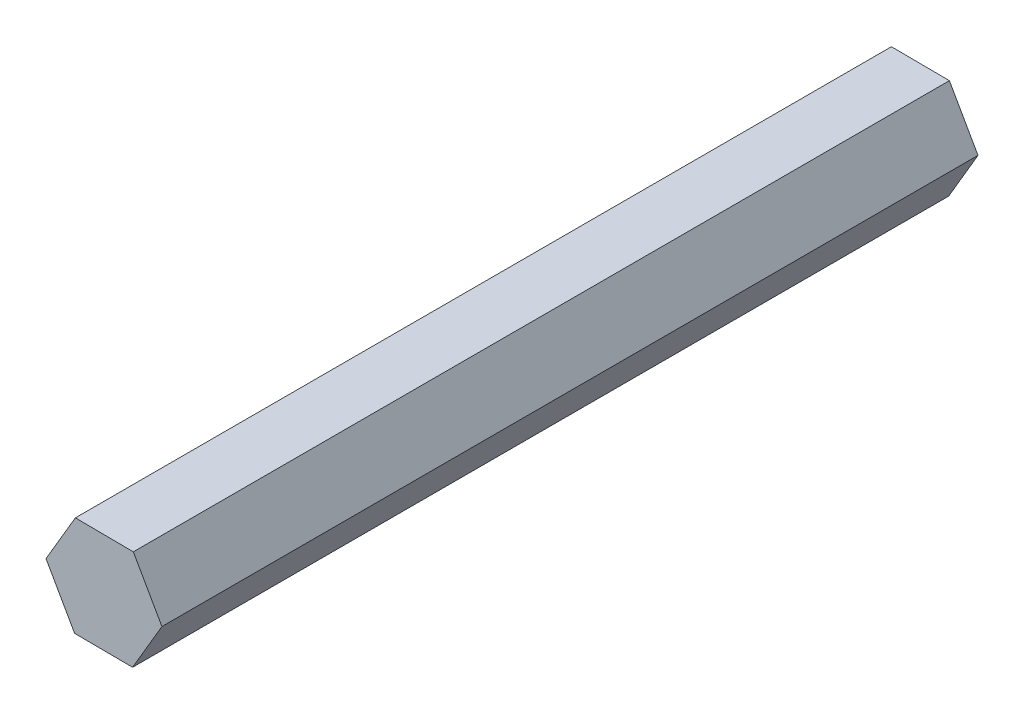
from build123d import *

# Parameters (mm, degrees)
BOSS_EXTRUDE1_DEPTH = 40.64


with BuildPart() as part:
    # Sketch1 → Boss-Extrude1 (new body)
    with BuildSketch(Plane.XY):
        Polygon((-1.424738806, 2.510667773), (-2.886671475, 0.021473887), (-1.461932669, -2.489193886), (1.424738806, -2.510667773), (2.886671475, -0.021473887), (1.461932669, 2.489193886), align=None)
    extrude(amount=BOSS_EXTRUDE1_DEPTH)


solid = part.part
